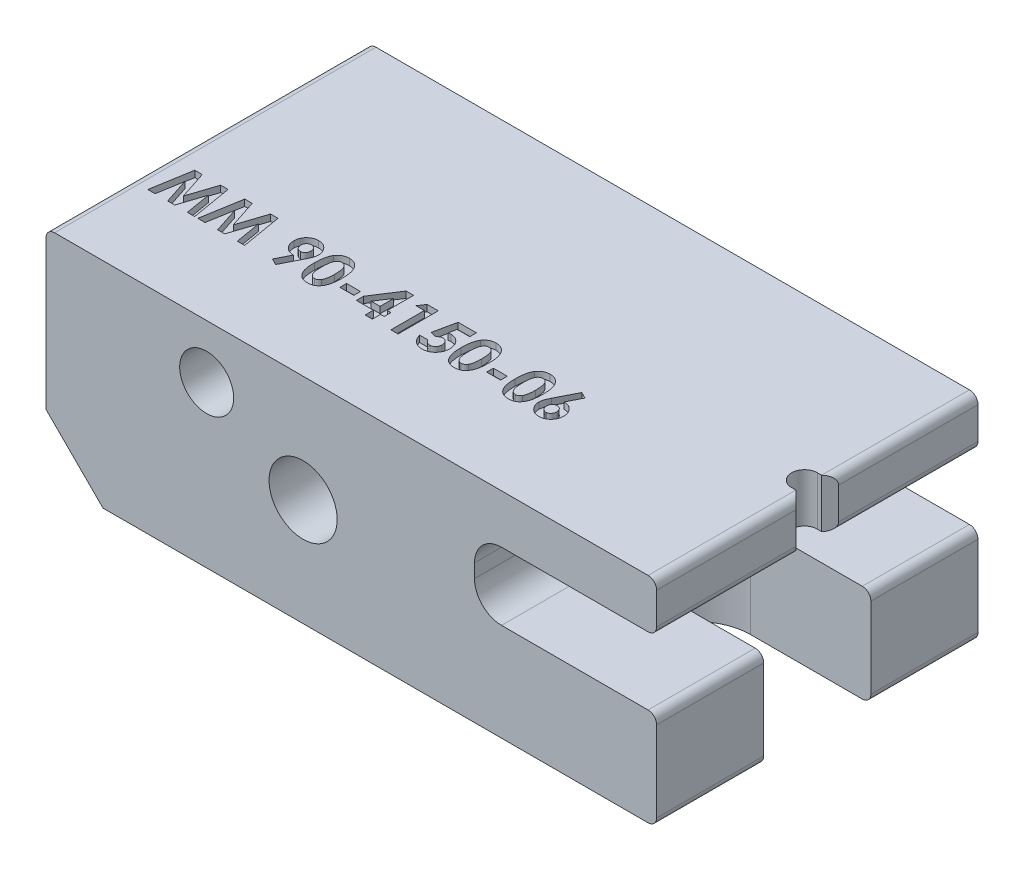
from build123d import *

# Parameters (mm, degrees)
CROQUIS1_W                          = 36.195
CROQUIS1_H                          = 19.05
SALIENTE_EXTRUIR1_DEPTH             = 12.7
TALADRO_ROSCADO_10_321_D            = 4.0386
TALADROS_DE_ESPIGA_DE_1_8_0_126_1_D = 3.2004
CORTAR_EXTRUIR1_DEPTH               = 43.828384571
CORTAR_EXTRUIR2_DEPTH               = 43.828384571
REDONDEO1_R                         = 0.508
CORTAR_EXTRUIR3_DEPTH               = 43.828384571
CORTAR_EXTRUIR4_REACH               = 44.828
CORTAR_EXTRUIR5_DEPTH               = 43.828384646
CROQUIS12_W                         = 0.824278847
CROQUIS12_H                         = 0.396875
CROQUIS12_W_2                       = 0.824278846
CORTAR_EXTRUIR6_DEPTH               = 0.381


with BuildPart() as part:
    # Croquis1 → Saliente-Extruir1 (new body)
    with BuildSketch(Plane(origin=(0, 0, 0), x_dir=(1, 0, 0), z_dir=(0, 1, 0))):
        with Locations((18.0975, -9.525)):
            Rectangle(CROQUIS1_W, CROQUIS1_H)
    extrude(amount=SALIENTE_EXTRUIR1_DEPTH)

    # Taladro roscado #10-321 (through all)
    with Locations(Plane.XY.offset(19.05)):
        with Locations((15.24, 6.35)):
            Hole(TALADRO_ROSCADO_10_321_D / 2)

    # Taladros de espiga de 1/8 (0.126)1 (through all)
    with Locations(Plane.XY.offset(19.05)):
        with Locations((9.525, 9.525)):
            Hole(TALADROS_DE_ESPIGA_DE_1_8_0_126_1_D / 2)

    # Croquis6 → Cortar-Extruir1 (cut, through all)
    with BuildSketch(Plane.XY.offset(19.05)):
        with BuildLine():
            Line((36.195, 5.7912), (27.0002, 5.7912))
            ThreePointArc((27.0002, 5.7912), (25.868687729, 6.259887729), (25.4, 7.3914))
            Line((25.4, 7.3914), (25.4, 8.2042))
            ThreePointArc((25.4, 8.2042), (25.868687729, 9.335712271), (27.0002, 9.8044))
            Line((27.0002, 9.8044), (36.195, 9.8044))
            ThreePointArc((36.195, 9.8044), (38.2016, 7.7978), (36.195, 5.7912))
        make_face()
    extrude(amount=-CORTAR_EXTRUIR1_DEPTH, mode=Mode.SUBTRACT)

    # Croquis7 → Cortar-Extruir2 (cut, through all)
    with BuildSketch(Plane.XY.offset(19.05)):
        Polygon((0, 3.3782), (3.3782, 0), (0, 0), align=None)
    extrude(amount=-CORTAR_EXTRUIR2_DEPTH, mode=Mode.SUBTRACT)

    # Redondeo1
    redondeo1_edges = [part.edges().sort_by_distance(p)[0] for p in [
        (36.195, 12.7, 9.525),
        (36.195, 9.8044, 9.525),
        (36.195, 5.7912, 9.525),
        (0, 12.7, 9.525),
        (36.195, 0, 9.525),
    ]]
    fillet(redondeo1_edges, radius=REDONDEO1_R)

    # Croquis8 → Cortar-Extruir3 (cut, through all)
    with BuildSketch(Plane(origin=(0, 12.7, 0), x_dir=(1, 0, 0), z_dir=(0, 1, 0))):
        with BuildLine():
            Line((36.195, -10.287), (35.433, -10.287))
            ThreePointArc((35.433, -10.287), (34.671, -9.525), (35.433, -8.763))
            Line((35.433, -8.763), (36.195, -8.763))
            ThreePointArc((36.195, -8.763), (36.957, -9.525), (36.195, -10.287))
        make_face()
    extrude(amount=-CORTAR_EXTRUIR3_DEPTH, mode=Mode.SUBTRACT)

    # Croquis9 → Cortar-Extruir4 (cut, up to next)
    with BuildSketch(Plane(origin=(0, 0, 0), x_dir=(1, 0, 0), z_dir=(0, 1, 0)), mode=Mode.PRIVATE) as cortar_extruir4_sk1:
        with BuildLine():
            Line((36.195, -12.7), (29.0576, -12.7))
            ThreePointArc((29.0576, -12.7), (25.8826, -9.525), (29.0576, -6.35))
            Line((29.0576, -6.35), (36.195, -6.35))
            ThreePointArc((36.195, -6.35), (39.37, -9.525), (36.195, -12.7))
        make_face()
    cortar_extruir4_tool1 = extrude(cortar_extruir4_sk1.sketch, amount=CORTAR_EXTRUIR4_REACH, mode=Mode.PRIVATE) & part.part
    add(cortar_extruir4_tool1.solids().sort_by_distance((32.6263, 0, 9.525))[0], mode=Mode.SUBTRACT)

    # Croquis11 → Cortar-Extruir5 (cut, through all)
    with BuildSketch(Plane(origin=(0, 12.7, 0), x_dir=(1, 0, 0), z_dir=(0, 1, 0))):
        Polygon((35.687, -8.763), (36.195, -8.255), (36.195, -8.763), align=None)
        Polygon((35.687, -10.287), (36.195, -10.795), (36.195, -10.287), align=None)
    extrude(amount=-CORTAR_EXTRUIR5_DEPTH, mode=Mode.SUBTRACT)

    # Croquis12 → Cortar-Extruir6 (cut)
    # profile 1 of 12: a face of its own
    with BuildSketch(Plane(origin=(0, 12.7, 0), x_dir=(1, 0, 0), z_dir=(0, 1, 0))):
        Polygon((1.45230255, -11.68486249), (1.895924846, -11.68486249), (2.439242904, -13.345822526), (2.986377069, -11.68486249), (3.425706246, -11.68486249), (3.828305404, -14.06611249), (3.395654413, -14.06611249), (3.141406366, -12.562089804), (2.646266642, -14.06611249), (2.229357087, -14.06611249), (1.737079443, -12.562089804), (1.483308409, -14.06611249), (1.050180404, -14.06611249), align=None)
    # profile 2 of 12: a face of its own
    with BuildSketch(Plane(origin=(0, 12.7, 0), x_dir=(1, 0, 0), z_dir=(0, 1, 0))):
        Polygon((4.413600627, -11.68486249), (4.857222922, -11.68486249), (5.400540981, -13.345822526), (5.947675146, -11.68486249), (6.387004323, -11.68486249), (6.789603481, -14.06611249), (6.35695249, -14.06611249), (6.102704443, -12.562089804), (5.607564719, -14.06611249), (5.190655164, -14.06611249), (4.69837752, -12.562089804), (4.444606486, -14.06611249), (4.011478481, -14.06611249), align=None)
    # profile 3 of 12: a face of its own
    with BuildSketch(Plane(origin=(0, 12.7, 0), x_dir=(1, 0, 0), z_dir=(0, 1, 0))):
        with BuildLine():
            Line((8.691932207, -14.127170182), (8.31318371, -13.936364894))
            Line((8.31318371, -13.936364894), (8.728185212, -13.119718259))
            add(Edge.make_bspline(
                [(8.728185212, -13.119718259), (8.703665971, -13.119093296), (8.655528767, -13.117866343), (8.584650491, -13.107670372), (8.516871302, -13.090265199), (8.451392306, -13.067094529), (8.389119058, -13.036031844), (8.329296445, -12.99896016), (8.272752613, -12.954419065), (8.219222453, -12.904353033), (8.170347706, -12.849013861), (8.12792546, -12.789497518), (8.090949592, -12.727313759), (8.06219513, -12.661058742), (8.039099399, -12.591967294), (8.022224493, -12.519681792), (8.012754743, -12.443885092), (8.01143114, -12.392298687), (8.010757327, -12.36603737)],
                knots=[0, 0, 0, 0, 1.014336294, 1.991387562, 2.955278539, 3.906441712, 4.859855302, 5.829322156, 6.813833455, 7.833278715, 8.858926674, 9.863225732, 10.85404919, 11.846815163, 12.845559416, 13.865450493, 14.913355531, 16, 16, 16, 16], degree=3))
            add(Edge.make_bspline(
                [(8.010757327, -12.36603737), (8.011382325, -12.340564151), (8.01261387, -12.2903697), (8.022841971, -12.216700581), (8.039674778, -12.145967464), (8.062768787, -12.078182366), (8.093512789, -12.013802372), (8.12949786, -11.951819443), (8.173487978, -11.893515937), (8.223181845, -11.838639459), (8.277569146, -11.788437171), (8.335269506, -11.744297092), (8.396020571, -11.707400227), (8.45904163, -11.676413667), (8.525471834, -11.653262437), (8.594351191, -11.635795006), (8.666192809, -11.625713801), (8.7149574, -11.624446224), (8.739633529, -11.623804798)],
                knots=[0, 0, 0, 0, 1.055538678, 2.079917126, 3.075849687, 4.065898488, 5.041806164, 6.028602842, 7.031727914, 8.062953097, 9.093756959, 10.095582084, 11.068815425, 12.035667573, 13.000833448, 13.979119574, 14.977382875, 16, 16, 16, 16], degree=3))
            add(Edge.make_bspline(
                [(8.739633529, -11.623804798), (8.765435407, -11.624335901), (8.81617131, -11.625380245), (8.890441857, -11.636904166), (8.96150091, -11.654583968), (9.029637195, -11.678596746), (9.094004826, -11.711187057), (9.1551424, -11.750246771), (9.212846553, -11.79664011), (9.266497586, -11.849029875), (9.315292601, -11.906013546), (9.35854331, -11.965661703), (9.394875742, -12.027857717), (9.424634227, -12.092046509), (9.447815936, -12.158328639), (9.463750407, -12.226798126), (9.474329128, -12.297337883), (9.475532776, -12.345169052), (9.476141943, -12.369376462)],
                knots=[0, 0, 0, 0, 1.062826075, 2.08990367, 3.089830715, 4.078784409, 5.060762809, 6.057138927, 7.064407536, 8.107320944, 9.143871033, 10.153461498, 11.140480137, 12.108246174, 13.065926856, 14.029354859, 15.002654194, 16, 16, 16, 16], degree=3))
            add(Edge.make_bspline(
                [(9.476141943, -12.369376462), (9.475809515, -12.387838879), (9.475139929, -12.425026338), (9.468556058, -12.480792964), (9.458566999, -12.536714152), (9.446972581, -12.583730002), (9.434817447, -12.623361508), (9.422989117, -12.65698149), (9.407813022, -12.694305984), (9.390867394, -12.735585165), (9.371242364, -12.78063802), (9.34853104, -12.829249179), (9.324106035, -12.882139594), (9.306102395, -12.918305339), (9.296784972, -12.937022196)],
                knots=[0, 0, 0, 0, 1.105131805, 2.225983929, 3.357782449, 4.505488967, 5.122909461, 5.839607681, 6.638776516, 7.535249922, 8.51168636, 9.581005249, 10.748097757, 12, 12, 12, 12], degree=3))
            Line((9.296784972, -12.937022196), (8.691932207, -14.127170182))
        make_face()
        with BuildLine():
            add(Edge.make_bspline(
                [(8.749173794, -12.722843259), (8.769653205, -12.721637577), (8.809665339, -12.719281947), (8.867140107, -12.701067712), (8.918577103, -12.669898209), (8.96416758, -12.62848911), (9.001842154, -12.577968114), (9.029234035, -12.520454452), (9.046106591, -12.457139167), (9.047844079, -12.413050637), (9.048738097, -12.390365044)],
                knots=[0, 0, 0, 0, 0.984774978, 1.924027336, 2.867853169, 3.859505234, 4.871392407, 5.881338128, 6.909850265, 8, 8, 8, 8], degree=3))
            add(Edge.make_bspline(
                [(9.048738097, -12.390365044), (9.047661349, -12.367207539), (9.045566819, -12.322160662), (9.028532631, -12.257325568), (8.99942463, -12.198718488), (8.959824861, -12.147772796), (8.913592646, -12.10513776), (8.86189336, -12.073994014), (8.80598237, -12.05473572), (8.767290008, -12.052392454), (8.747742754, -12.051208644)],
                knots=[0, 0, 0, 0, 1.104110315, 2.147758178, 3.172670271, 4.206310416, 5.210906102, 6.157051016, 7.068948237, 8, 8, 8, 8], degree=3))
            add(Edge.make_bspline(
                [(8.747742754, -12.051208644), (8.727082404, -12.052362706), (8.686515976, -12.054628698), (8.628327346, -12.073840745), (8.574686565, -12.104386427), (8.527843289, -12.147166121), (8.48730223, -12.197440875), (8.459031843, -12.25624578), (8.441147015, -12.32062843), (8.43917435, -12.36575609), (8.438161174, -12.388934004)],
                knots=[0, 0, 0, 0, 0.970967322, 1.90648639, 2.855811969, 3.858352357, 4.877096915, 5.878517833, 6.91039038, 8, 8, 8, 8], degree=3))
            add(Edge.make_bspline(
                [(8.438161174, -12.388934004), (8.439219499, -12.411781535), (8.441277831, -12.456217596), (8.458528748, -12.519891967), (8.486628764, -12.577709996), (8.52504349, -12.628629421), (8.572360973, -12.670242548), (8.626086331, -12.701080032), (8.686015726, -12.719331335), (8.727742132, -12.721651545), (8.749173794, -12.722843259)],
                knots=[0, 0, 0, 0, 1.075706617, 2.092137047, 3.084482865, 4.090466434, 5.0784141, 6.035155512, 6.990809768, 8, 8, 8, 8], degree=3))
        make_face(mode=Mode.SUBTRACT)
    # profile 4 of 12: a face of its own
    with BuildSketch(Plane(origin=(0, 12.7, 0), x_dir=(1, 0, 0), z_dir=(0, 1, 0))):
        with BuildLine():
            add(Edge.make_bspline(
                [(10.552760783, -11.623804798), (10.573448903, -11.624111919), (10.614127275, -11.624715801), (10.674038859, -11.631256333), (10.731750279, -11.641137254), (10.787487309, -11.654917693), (10.840848749, -11.673155614), (10.892222973, -11.694986092), (10.940998481, -11.721554181), (10.987797315, -11.751564202), (11.032601449, -11.785539801), (11.074334046, -11.824273737), (11.113757233, -11.866874742), (11.150017642, -11.913986866), (11.183918272, -11.965181575), (11.21534773, -12.020466987), (11.244065417, -12.080113686), (11.27039319, -12.144229309), (11.293935567, -12.213774923), (11.313765282, -12.289548245), (11.33077258, -12.371566581), (11.34512794, -12.460034085), (11.355978273, -12.555068352), (11.363291615, -12.656606246), (11.368310376, -12.764452018), (11.368719973, -12.838433331), (11.368930404, -12.876441516)],
                knots=[0, 0, 0, 0, 0.879237366, 1.728815576, 2.559023295, 3.367336655, 4.166867292, 4.954216142, 5.737608147, 6.525189134, 7.316157332, 8.124696809, 8.942788509, 9.781158001, 10.649253743, 11.551476218, 12.482711956, 13.461909668, 14.496590415, 15.601789533, 16.789733467, 18.056700938, 19.410929216, 20.8549011, 22.384193279, 24, 24, 24, 24], degree=3))
            add(Edge.make_bspline(
                [(11.368930404, -12.876441516), (11.368702985, -12.914925227), (11.368261112, -12.989698387), (11.363500246, -13.098530571), (11.35530181, -13.200805691), (11.344735074, -13.296513167), (11.330261537, -13.385602458), (11.313311012, -13.468304244), (11.293168291, -13.544588547), (11.268850435, -13.614283485), (11.242682026, -13.678511709), (11.213885784, -13.738042111), (11.182963623, -13.793035932), (11.150624806, -13.844322828), (11.115096398, -13.890390887), (11.078107669, -13.932806665), (11.038048062, -13.96995449), (10.996604241, -14.003748794), (10.952257953, -14.032953855), (10.905466528, -14.058496119), (10.855395757, -14.079213929), (10.802958344, -14.097233174), (10.747260485, -14.110169048), (10.689187208, -14.120433238), (10.628082881, -14.126105859), (10.586480593, -14.126809585), (10.565163127, -14.127170182)],
                knots=[0, 0, 0, 0, 1.643780988, 3.193836972, 4.651895693, 6.025988579, 7.305620092, 8.505800249, 9.631074763, 10.672816429, 11.65661981, 12.592235626, 13.49536222, 14.350718032, 15.179365177, 15.97804903, 16.751647189, 17.51006938, 18.259804725, 19.016521909, 19.783502495, 20.571750527, 21.382245291, 22.22305063, 23.089471752, 24, 24, 24, 24], degree=3))
            add(Edge.make_bspline(
                [(10.565163127, -14.127170182), (10.543846236, -14.12680263), (10.50208676, -14.1260826), (10.4408172, -14.120475417), (10.382436165, -14.110127467), (10.326297646, -14.097133862), (10.272792357, -14.079253799), (10.221663744, -14.057916127), (10.17330494, -14.032533233), (10.127582048, -14.003260127), (10.084651178, -13.969691933), (10.043845186, -13.932187698), (10.005254336, -13.890842488), (9.969465691, -13.845193202), (9.935893137, -13.795849161), (9.904886782, -13.742246882), (9.87646526, -13.684464408), (9.84973954, -13.622421196), (9.826518273, -13.554781527), (9.805852424, -13.480941387), (9.788923504, -13.400285258), (9.775308133, -13.312839052), (9.764437629, -13.218788027), (9.756351224, -13.118086787), (9.751563913, -13.010688428), (9.751126675, -12.936868186), (9.750901558, -12.898861138)],
                knots=[0, 0, 0, 0, 0.917216111, 1.796812873, 2.643793957, 3.46689424, 4.273913431, 5.068098542, 5.848489301, 6.620921603, 7.401012384, 8.190319798, 9.003608147, 9.831726257, 10.68377682, 11.569763213, 12.493818149, 13.453288342, 14.474581811, 15.568529029, 16.750744269, 18.018426408, 19.375425659, 20.823733699, 22.36466933, 24, 24, 24, 24], degree=3))
            add(Edge.make_bspline(
                [(9.750901558, -12.898861138), (9.751309336, -12.846053337), (9.752096147, -12.744160004), (9.762067203, -12.596953765), (9.776702185, -12.460887096), (9.798197505, -12.336187604), (9.824776172, -12.222393438), (9.858811539, -12.120254216), (9.897558328, -12.028356611), (9.93057557, -11.973915916), (9.946476979, -11.947696775)],
                knots=[0, 0, 0, 0, 1.288568992, 2.486310467, 3.599230591, 4.627010532, 5.572937695, 6.447898582, 7.252493626, 8, 8, 8, 8], degree=3))
            add(Edge.make_bspline(
                [(9.946476979, -11.947696775), (9.96496638, -11.921939099), (10.001116801, -11.871577767), (10.064326824, -11.805462751), (10.132237763, -11.748917952), (10.206244471, -11.70322303), (10.285176502, -11.66718801), (10.369711525, -11.641736881), (10.459537369, -11.626907868), (10.521222274, -11.624854601), (10.552760783, -11.623804798)],
                knots=[0, 0, 0, 0, 1.058512271, 2.069600068, 3.047294572, 4.004278952, 4.967380941, 5.939006123, 6.946246673, 8, 8, 8, 8], degree=3))
        make_face()
        with BuildLine():
            add(Edge.make_bspline(
                [(10.563255074, -12.051208644), (10.544552842, -12.052095092), (10.507886539, -12.053833002), (10.454681987, -12.068585405), (10.404513416, -12.091371286), (10.366351524, -12.118790532), (10.337787728, -12.145075167), (10.317829998, -12.168861907), (10.298583914, -12.195406194), (10.281584803, -12.225905837), (10.265533204, -12.259264945), (10.249845955, -12.295634951), (10.236986529, -12.33590918), (10.224352484, -12.379401756), (10.213283882, -12.427315134), (10.20401082, -12.480040952), (10.195726155, -12.537922093), (10.189947502, -12.600996467), (10.184560063, -12.669198084), (10.180698091, -12.74267887), (10.179083498, -12.821419002), (10.178570268, -12.875646162), (10.178305404, -12.90363127)],
                knots=[0, 0, 0, 0, 1.076674018, 2.110852608, 3.161083442, 4.239746716, 4.804137807, 5.395870207, 6.026861976, 6.692161227, 7.405688833, 8.16177676, 8.973626916, 9.841385931, 10.773283133, 11.807421078, 12.927755683, 14.143907515, 15.458935494, 16.872852025, 18.386167141, 20, 20, 20, 20], degree=3))
            add(Edge.make_bspline(
                [(10.178305404, -12.90363127), (10.178741338, -12.93988733), (10.179577272, -13.009411013), (10.183955506, -13.10938849), (10.192731312, -13.200376045), (10.203646643, -13.282990334), (10.218977671, -13.35669558), (10.236617011, -13.422189105), (10.258400027, -13.478636024), (10.2835745, -13.526852687), (10.311456363, -13.567870502), (10.341723352, -13.60273583), (10.373344984, -13.632927559), (10.407308274, -13.657451928), (10.443532194, -13.676246274), (10.481714343, -13.689764815), (10.521878983, -13.698040077), (10.549383315, -13.69918759), (10.563255074, -13.699766336)],
                knots=[0, 0, 0, 0, 1.771748488, 3.397459088, 4.888034009, 6.237357457, 7.467047327, 8.564189669, 9.548206622, 10.417051504, 11.216568818, 11.965764335, 12.669334354, 13.348544111, 14.005342236, 14.656555988, 15.322436492, 16, 16, 16, 16], degree=3))
            add(Edge.make_bspline(
                [(10.563255074, -13.699766336), (10.576650798, -13.699370315), (10.60287796, -13.698594955), (10.641123037, -13.690635991), (10.677290298, -13.677696443), (10.711270545, -13.659392544), (10.74318532, -13.636116336), (10.772878643, -13.607765533), (10.800126572, -13.574057545), (10.81600134, -13.549041232), (10.824181306, -13.536150801)],
                knots=[0, 0, 0, 0, 0.992283464, 1.942767638, 2.88273346, 3.832339453, 4.79467288, 5.803907806, 6.868395428, 8, 8, 8, 8], degree=3))
            add(Edge.make_bspline(
                [(10.824181306, -13.536150801), (10.833811838, -13.51853644), (10.854006283, -13.481600552), (10.87737533, -13.41927262), (10.897046092, -13.348977013), (10.913976428, -13.270494965), (10.925555746, -13.183516934), (10.93552784, -13.088594455), (10.940337628, -12.985249536), (10.941119967, -12.913651804), (10.941526558, -12.876441516)],
                knots=[0, 0, 0, 0, 0.710965849, 1.490837728, 2.352621235, 3.297892224, 4.334225155, 5.461620853, 6.680770821, 8, 8, 8, 8], degree=3))
            add(Edge.make_bspline(
                [(10.941526558, -12.876441516), (10.941369501, -12.838908226), (10.941067192, -12.766663048), (10.935520698, -12.662946597), (10.927796781, -12.568218833), (10.916498921, -12.482691243), (10.901962171, -12.406156204), (10.884045571, -12.33861872), (10.862923233, -12.279945687), (10.837874656, -12.230195611), (10.810131802, -12.18791487), (10.780681915, -12.151641274), (10.74940047, -12.120671793), (10.716339779, -12.094889884), (10.68073464, -12.075190571), (10.64326516, -12.061281227), (10.603854521, -12.05286654), (10.576970886, -12.051768735), (10.563255074, -12.051208644)],
                knots=[0, 0, 0, 0, 1.793836731, 3.452829483, 4.963243077, 6.335886805, 7.574563692, 8.684454726, 9.672768357, 10.54971625, 11.340229787, 12.085688095, 12.778991901, 13.440269426, 14.083255152, 14.715733572, 15.344777694, 16, 16, 16, 16], degree=3))
        make_face(mode=Mode.SUBTRACT)
    # profile 5 of 12: a face of its own
    with BuildSketch(Plane(origin=(0, 12.7, 0), x_dir=(1, 0, 0), z_dir=(0, 1, 0))):
        with Locations((12.177944827, -13.196040375)):
            Rectangle(CROQUIS12_W, CROQUIS12_H)
    # profile 6 of 12: a face of its own
    with BuildSketch(Plane(origin=(0, 12.7, 0), x_dir=(1, 0, 0), z_dir=(0, 1, 0))):
        Polygon((13.915226979, -11.623804798), (14.360757327, -11.623804798), (14.360757327, -13.180775952), (14.574459251, -13.180775952), (14.574459251, -13.577650952), (14.360757327, -13.577650952), (14.360757327, -14.06611249), (13.933353481, -14.06611249), (13.933353481, -13.577650952), (12.925901558, -13.577650952), (12.925901558, -13.14499996), align=None)
        Polygon((13.933353481, -13.180775952), (13.933353481, -12.370330489), (13.406253872, -13.180775952), align=None, mode=Mode.SUBTRACT)
    # profile 7 of 12: a face of its own
    with BuildSketch(Plane(origin=(0, 12.7, 0), x_dir=(1, 0, 0), z_dir=(0, 1, 0))):
        Polygon((15.226536324, -11.68486249), (15.887199635, -11.68486249), (15.887199635, -14.06611249), (15.459795789, -14.06611249), (15.459795789, -12.08173749), (14.971334251, -12.08173749), align=None)
    # profile 8 of 12: a face of its own
    with BuildSketch(Plane(origin=(0, 12.7, 0), x_dir=(1, 0, 0), z_dir=(0, 1, 0))):
        with BuildLine():
            Line((17.062083199, -11.68486249), (18.146334251, -11.68486249))
            Line((18.146334251, -11.68486249), (18.146334251, -12.08173749))
            Line((18.146334251, -12.08173749), (17.400762586, -12.08173749))
            Line((17.400762586, -12.08173749), (17.307745008, -12.532037971))
            add(Edge.make_bspline(
                [(17.307745008, -12.532037971), (17.320419984, -12.52850783), (17.345417642, -12.521545666), (17.383076645, -12.514563498), (17.419573467, -12.510037878), (17.443522458, -12.50943422), (17.455142093, -12.509141336)],
                knots=[0, 0, 0, 0, 1.05461699, 2.079921384, 3.068411212, 4, 4, 4, 4], degree=3))
            add(Edge.make_bspline(
                [(17.455142093, -12.509141336), (17.480462494, -12.509721538), (17.530374583, -12.510865245), (17.603389635, -12.521722751), (17.673305861, -12.538822994), (17.739909309, -12.563211469), (17.803134917, -12.594953699), (17.863059326, -12.633352899), (17.919756084, -12.678476512), (17.972218017, -12.730352789), (18.020422233, -12.787314117), (18.062333049, -12.848923819), (18.098127502, -12.914303403), (18.126597172, -12.983859265), (18.149067862, -13.057154549), (18.165305685, -13.134236224), (18.174907921, -13.215195644), (18.176202724, -13.270428468), (18.176863097, -13.298598217)],
                knots=[0, 0, 0, 0, 1.01440847, 1.999622559, 2.951875003, 3.895578053, 4.836219714, 5.782137149, 6.743708247, 7.735272588, 8.734977101, 9.730283169, 10.717124674, 11.717316708, 12.737475749, 13.78628267, 14.87096371, 16, 16, 16, 16], degree=3))
            add(Edge.make_bspline(
                [(18.176863097, -13.298598217), (18.17605611, -13.327087758), (18.17446369, -13.383305951), (18.164074608, -13.46596658), (18.145737692, -13.545136802), (18.120550102, -13.621028554), (18.087367066, -13.693084048), (18.047459923, -13.762049727), (18.000153951, -13.82741368), (17.945913384, -13.888505848), (17.886946774, -13.944345262), (17.824161252, -13.993467301), (17.757997908, -14.034803099), (17.688455145, -14.068209413), (17.615931951, -14.094639893), (17.540406315, -14.113880021), (17.461511192, -14.124913166), (17.407951654, -14.126409576), (17.380728031, -14.127170182)],
                knots=[0, 0, 0, 0, 1.06808661, 2.107647099, 3.116961351, 4.110378221, 5.100014249, 6.085620622, 7.093190682, 8.119403071, 9.144090782, 10.133780668, 11.103064255, 12.062861538, 13.020824475, 13.992378307, 14.979551724, 16, 16, 16, 16], degree=3))
            add(Edge.make_bspline(
                [(17.380728031, -14.127170182), (17.356382754, -14.126547959), (17.308368774, -14.125320805), (17.237646289, -14.117778068), (17.169461961, -14.104442438), (17.104177772, -14.085142329), (17.041106825, -14.061388301), (16.980978237, -14.0316794), (16.923461592, -13.996581323), (16.868720215, -13.956734612), (16.817643576, -13.911848836), (16.771026231, -13.862713622), (16.728585955, -13.809948293), (16.691230902, -13.752901887), (16.659078169, -13.691658685), (16.630564469, -13.626940455), (16.60722572, -13.558071329), (16.595381978, -13.510327425), (16.589363097, -13.486064413)],
                knots=[0, 0, 0, 0, 1.054957082, 2.080596141, 3.077793124, 4.061112343, 5.027190972, 5.994718051, 6.962465889, 7.943658696, 8.924948258, 9.904494768, 10.875059, 11.855380583, 12.854004648, 13.869083016, 14.917087635, 16, 16, 16, 16], degree=3))
            Line((16.589363097, -13.486064413), (17.077824635, -13.486064413))
            add(Edge.make_bspline(
                [(17.077824635, -13.486064413), (17.086753724, -13.502877692), (17.104106389, -13.535552382), (17.137114994, -13.578932941), (17.174066031, -13.615926019), (17.214626183, -13.646893045), (17.259058254, -13.670093014), (17.305551721, -13.687686797), (17.354690661, -13.697853593), (17.388156449, -13.699124543), (17.405055705, -13.699766336)],
                knots=[0, 0, 0, 0, 1.104910296, 2.147267069, 3.153527244, 4.136738762, 5.099945312, 6.05603338, 7.018353, 8, 8, 8, 8], degree=3))
            add(Edge.make_bspline(
                [(17.405055705, -13.699766336), (17.41683426, -13.699323172), (17.440008765, -13.69845124), (17.474152734, -13.6938385), (17.506744653, -13.685102075), (17.538026834, -13.673004156), (17.568083309, -13.657916686), (17.596483209, -13.638869738), (17.623720641, -13.616945994), (17.64938094, -13.591788424), (17.672621775, -13.563743585), (17.693001445, -13.533607494), (17.71122368, -13.502049781), (17.724721168, -13.467820365), (17.73577447, -13.43194135), (17.743914568, -13.39414209), (17.748779195, -13.354378436), (17.749229529, -13.327232905), (17.749459251, -13.313385627)],
                knots=[0, 0, 0, 0, 0.978869489, 1.925942215, 2.855067702, 3.774946051, 4.70828698, 5.642468714, 6.60995405, 7.609372294, 8.622401667, 9.629904756, 10.629323, 11.642352373, 12.678539694, 13.745912462, 14.850161547, 16, 16, 16, 16], degree=3))
            add(Edge.make_bspline(
                [(17.749459251, -13.313385627), (17.749192633, -13.299859776), (17.748673654, -13.273531379), (17.74438056, -13.234871861), (17.736700299, -13.198190975), (17.726235876, -13.163207773), (17.712840166, -13.13013469), (17.696469713, -13.098774858), (17.677054581, -13.06928679), (17.654490533, -13.042270834), (17.630428465, -13.017491031), (17.604578072, -12.995818813), (17.577172252, -12.977832377), (17.549062608, -12.962129695), (17.519127104, -12.950701625), (17.488038869, -12.942831535), (17.455830596, -12.937056779), (17.433862032, -12.936717491), (17.422705194, -12.936545182)],
                knots=[0, 0, 0, 0, 1.166249705, 2.270133367, 3.348514167, 4.393962215, 5.415026464, 6.420877785, 7.440098956, 8.453121383, 9.451844239, 10.415694839, 11.355045125, 12.27538808, 13.187007209, 14.108269027, 15.039275622, 16, 16, 16, 16], degree=3))
            add(Edge.make_bspline(
                [(17.422705194, -12.936545182), (17.410586276, -12.937005028), (17.386297363, -12.937926657), (17.350210118, -12.945425709), (17.314557985, -12.957561987), (17.279142701, -12.974305906), (17.244315824, -12.996218413), (17.209158257, -13.021919272), (17.174846798, -13.053275893), (17.153030617, -13.076630376), (17.141744407, -13.0887124)],
                knots=[0, 0, 0, 0, 0.88288272, 1.769486374, 2.674910571, 3.623812639, 4.617874466, 5.670434592, 6.794841017, 8, 8, 8, 8], degree=3))
            Line((17.141744407, -13.0887124), (16.782076438, -13.006189113))
            Line((16.782076438, -13.006189113), (17.062083199, -11.68486249))
        make_face()
    # profile 9 of 12: a face of its own
    with BuildSketch(Plane(origin=(0, 12.7, 0), x_dir=(1, 0, 0), z_dir=(0, 1, 0))):
        with BuildLine():
            add(Edge.make_bspline(
                [(19.253481937, -11.623804798), (19.274170057, -11.624111919), (19.314848429, -11.624715801), (19.374760013, -11.631256333), (19.432471433, -11.641137254), (19.488208463, -11.654917693), (19.541569903, -11.673155614), (19.592944127, -11.694986092), (19.641719635, -11.721554181), (19.688518469, -11.751564202), (19.733322602, -11.785539801), (19.7750552, -11.824273737), (19.814478386, -11.866874742), (19.850738796, -11.913986866), (19.884639426, -11.965181575), (19.916068884, -12.020466987), (19.944786571, -12.080113686), (19.971114343, -12.144229309), (19.99465672, -12.213774923), (20.014486435, -12.289548245), (20.031493734, -12.371566581), (20.045849094, -12.460034085), (20.056699426, -12.555068352), (20.064012769, -12.656606246), (20.06903153, -12.764452018), (20.069441127, -12.838433331), (20.069651558, -12.876441516)],
                knots=[0, 0, 0, 0, 0.879237366, 1.728815576, 2.559023295, 3.367336655, 4.166867292, 4.954216142, 5.737608147, 6.525189134, 7.316157332, 8.124696809, 8.942788509, 9.781158001, 10.649253743, 11.551476218, 12.482711956, 13.461909668, 14.496590415, 15.601789533, 16.789733467, 18.056700938, 19.410929216, 20.8549011, 22.384193279, 24, 24, 24, 24], degree=3))
            add(Edge.make_bspline(
                [(20.069651558, -12.876441516), (20.069424138, -12.914925227), (20.068982266, -12.989698387), (20.0642214, -13.098530571), (20.056022964, -13.200805691), (20.045456228, -13.296513167), (20.03098269, -13.385602458), (20.014032166, -13.468304244), (19.993889445, -13.544588547), (19.969571589, -13.614283485), (19.94340318, -13.678511709), (19.914606938, -13.738042111), (19.883684777, -13.793035932), (19.85134596, -13.844322828), (19.815817552, -13.890390887), (19.778828823, -13.932806665), (19.738769215, -13.96995449), (19.697325395, -14.003748794), (19.652979107, -14.032953855), (19.606187682, -14.058496119), (19.556116911, -14.079213929), (19.503679498, -14.097233174), (19.447981638, -14.110169048), (19.389908362, -14.120433238), (19.328804034, -14.126105859), (19.287201747, -14.126809585), (19.265884281, -14.127170182)],
                knots=[0, 0, 0, 0, 1.643780988, 3.193836972, 4.651895693, 6.025988579, 7.305620092, 8.505800249, 9.631074763, 10.672816429, 11.65661981, 12.592235626, 13.49536222, 14.350718032, 15.179365177, 15.97804903, 16.751647189, 17.51006938, 18.259804725, 19.016521909, 19.783502495, 20.571750527, 21.382245291, 22.22305063, 23.089471752, 24, 24, 24, 24], degree=3))
            add(Edge.make_bspline(
                [(19.265884281, -14.127170182), (19.24456739, -14.12680263), (19.202807914, -14.1260826), (19.141538354, -14.120475417), (19.083157319, -14.110127467), (19.027018799, -14.097133862), (18.973513511, -14.079253799), (18.922384897, -14.057916127), (18.874026094, -14.032533233), (18.828303201, -14.003260127), (18.785372332, -13.969691933), (18.74456634, -13.932187698), (18.70597549, -13.890842488), (18.670186845, -13.845193202), (18.636614291, -13.795849161), (18.605607935, -13.742246882), (18.577186414, -13.684464408), (18.550460694, -13.622421196), (18.527239427, -13.554781527), (18.506573578, -13.480941387), (18.489644657, -13.400285258), (18.476029287, -13.312839052), (18.465158783, -13.218788027), (18.457072377, -13.118086787), (18.452285067, -13.010688428), (18.451847829, -12.936868186), (18.451622712, -12.898861138)],
                knots=[0, 0, 0, 0, 0.917216111, 1.796812873, 2.643793957, 3.46689424, 4.273913431, 5.068098542, 5.848489301, 6.620921603, 7.401012384, 8.190319798, 9.003608147, 9.831726257, 10.68377682, 11.569763213, 12.493818149, 13.453288342, 14.474581811, 15.568529029, 16.750744269, 18.018426408, 19.375425659, 20.823733699, 22.36466933, 24, 24, 24, 24], degree=3))
            add(Edge.make_bspline(
                [(18.451622712, -12.898861138), (18.452030489, -12.846053337), (18.452817301, -12.744160004), (18.462788357, -12.596953765), (18.477423338, -12.460887096), (18.498918659, -12.336187604), (18.525497326, -12.222393438), (18.559532693, -12.120254216), (18.598279482, -12.028356611), (18.631296724, -11.973915916), (18.647198133, -11.947696775)],
                knots=[0, 0, 0, 0, 1.288568992, 2.486310467, 3.599230591, 4.627010532, 5.572937695, 6.447898582, 7.252493626, 8, 8, 8, 8], degree=3))
            add(Edge.make_bspline(
                [(18.647198133, -11.947696775), (18.665687533, -11.921939099), (18.701837955, -11.871577767), (18.765047978, -11.805462751), (18.832958917, -11.748917952), (18.906965625, -11.70322303), (18.985897655, -11.66718801), (19.070432679, -11.641736881), (19.160258523, -11.626907868), (19.221943428, -11.624854601), (19.253481937, -11.623804798)],
                knots=[0, 0, 0, 0, 1.058512271, 2.069600068, 3.047294572, 4.004278952, 4.967380941, 5.939006123, 6.946246673, 8, 8, 8, 8], degree=3))
        make_face()
        with BuildLine():
            add(Edge.make_bspline(
                [(19.263976228, -12.051208644), (19.245273996, -12.052095092), (19.208607693, -12.053833002), (19.155403141, -12.068585405), (19.10523457, -12.091371286), (19.067072678, -12.118790532), (19.038508881, -12.145075167), (19.018551152, -12.168861907), (18.999305068, -12.195406194), (18.982305956, -12.225905837), (18.966254358, -12.259264945), (18.950567108, -12.295634951), (18.937707683, -12.33590918), (18.925073638, -12.379401756), (18.914005036, -12.427315134), (18.904731974, -12.480040952), (18.896447309, -12.537922093), (18.890668655, -12.600996467), (18.885281216, -12.669198084), (18.881419245, -12.74267887), (18.879804652, -12.821419002), (18.879291422, -12.875646162), (18.879026558, -12.90363127)],
                knots=[0, 0, 0, 0, 1.076674018, 2.110852608, 3.161083442, 4.239746716, 4.804137807, 5.395870207, 6.026861976, 6.692161227, 7.405688833, 8.16177676, 8.973626916, 9.841385931, 10.773283133, 11.807421078, 12.927755683, 14.143907515, 15.458935494, 16.872852025, 18.386167141, 20, 20, 20, 20], degree=3))
            add(Edge.make_bspline(
                [(18.879026558, -12.90363127), (18.879462492, -12.93988733), (18.880298426, -13.009411013), (18.88467666, -13.10938849), (18.893452466, -13.200376045), (18.904367797, -13.282990334), (18.919698825, -13.35669558), (18.937338165, -13.422189105), (18.959121181, -13.478636024), (18.984295654, -13.526852687), (19.012177517, -13.567870502), (19.042444506, -13.60273583), (19.074066138, -13.632927559), (19.108029428, -13.657451928), (19.144253348, -13.676246274), (19.182435497, -13.689764815), (19.222600137, -13.698040077), (19.250104469, -13.69918759), (19.263976228, -13.699766336)],
                knots=[0, 0, 0, 0, 1.771748488, 3.397459088, 4.888034009, 6.237357457, 7.467047327, 8.564189669, 9.548206622, 10.417051504, 11.216568818, 11.965764335, 12.669334354, 13.348544111, 14.005342236, 14.656555988, 15.322436492, 16, 16, 16, 16], degree=3))
            add(Edge.make_bspline(
                [(19.263976228, -13.699766336), (19.277371952, -13.699370315), (19.303599114, -13.698594955), (19.34184419, -13.690635991), (19.378011452, -13.677696443), (19.411991699, -13.659392544), (19.443906474, -13.636116336), (19.473599797, -13.607765533), (19.500847726, -13.574057545), (19.516722494, -13.549041232), (19.52490246, -13.536150801)],
                knots=[0, 0, 0, 0, 0.992283464, 1.942767638, 2.88273346, 3.832339453, 4.79467288, 5.803907806, 6.868395428, 8, 8, 8, 8], degree=3))
            add(Edge.make_bspline(
                [(19.52490246, -13.536150801), (19.534532992, -13.51853644), (19.554727437, -13.481600552), (19.578096484, -13.41927262), (19.597767245, -13.348977013), (19.614697582, -13.270494965), (19.626276899, -13.183516934), (19.636248993, -13.088594455), (19.641058782, -12.985249536), (19.641841121, -12.913651804), (19.642247712, -12.876441516)],
                knots=[0, 0, 0, 0, 0.710965849, 1.490837728, 2.352621235, 3.297892224, 4.334225155, 5.461620853, 6.680770821, 8, 8, 8, 8], degree=3))
            add(Edge.make_bspline(
                [(19.642247712, -12.876441516), (19.642090655, -12.838908226), (19.641788346, -12.766663048), (19.636241852, -12.662946597), (19.628517935, -12.568218833), (19.617220075, -12.482691243), (19.602683325, -12.406156204), (19.584766725, -12.33861872), (19.563644386, -12.279945687), (19.53859581, -12.230195611), (19.510852956, -12.18791487), (19.481403069, -12.151641274), (19.450121624, -12.120671793), (19.417060932, -12.094889884), (19.381455794, -12.075190571), (19.343986313, -12.061281227), (19.304575675, -12.05286654), (19.27769204, -12.051768735), (19.263976228, -12.051208644)],
                knots=[0, 0, 0, 0, 1.793836731, 3.452829483, 4.963243077, 6.335886805, 7.574563692, 8.684454726, 9.672768357, 10.54971625, 11.340229787, 12.085688095, 12.778991901, 13.440269426, 14.083255152, 14.715733572, 15.344777694, 16, 16, 16, 16], degree=3))
        make_face(mode=Mode.SUBTRACT)
    # profile 10 of 12: a face of its own
    with BuildSketch(Plane(origin=(0, 12.7, 0), x_dir=(1, 0, 0), z_dir=(0, 1, 0))):
        with Locations((20.878665981, -13.196040375)):
            Rectangle(CROQUIS12_W_2, CROQUIS12_H)
    # profile 11 of 12: a face of its own
    with BuildSketch(Plane(origin=(0, 12.7, 0), x_dir=(1, 0, 0), z_dir=(0, 1, 0))):
        with BuildLine():
            add(Edge.make_bspline(
                [(22.459010783, -11.623804798), (22.479698903, -11.624111919), (22.520377275, -11.624715801), (22.580288859, -11.631256333), (22.638000279, -11.641137254), (22.693737309, -11.654917693), (22.747098749, -11.673155614), (22.798472973, -11.694986092), (22.847248481, -11.721554181), (22.894047315, -11.751564202), (22.938851449, -11.785539801), (22.980584046, -11.824273737), (23.020007233, -11.866874742), (23.056267642, -11.913986866), (23.090168272, -11.965181575), (23.12159773, -12.020466987), (23.150315417, -12.080113686), (23.17664319, -12.144229309), (23.200185567, -12.213774923), (23.220015282, -12.289548245), (23.23702258, -12.371566581), (23.25137794, -12.460034085), (23.262228273, -12.555068352), (23.269541615, -12.656606246), (23.274560376, -12.764452018), (23.274969973, -12.838433331), (23.275180404, -12.876441516)],
                knots=[0, 0, 0, 0, 0.879237366, 1.728815576, 2.559023295, 3.367336655, 4.166867292, 4.954216142, 5.737608147, 6.525189134, 7.316157332, 8.124696809, 8.942788509, 9.781158001, 10.649253743, 11.551476218, 12.482711956, 13.461909668, 14.496590415, 15.601789533, 16.789733467, 18.056700938, 19.410929216, 20.8549011, 22.384193279, 24, 24, 24, 24], degree=3))
            add(Edge.make_bspline(
                [(23.275180404, -12.876441516), (23.274952985, -12.914925227), (23.274511112, -12.989698387), (23.269750246, -13.098530571), (23.26155181, -13.200805691), (23.250985074, -13.296513167), (23.236511537, -13.385602458), (23.219561012, -13.468304244), (23.199418291, -13.544588547), (23.175100435, -13.614283485), (23.148932026, -13.678511709), (23.120135784, -13.738042111), (23.089213623, -13.793035932), (23.056874806, -13.844322828), (23.021346398, -13.890390887), (22.984357669, -13.932806665), (22.944298062, -13.96995449), (22.902854241, -14.003748794), (22.858507953, -14.032953855), (22.811716528, -14.058496119), (22.761645757, -14.079213929), (22.709208344, -14.097233174), (22.653510485, -14.110169048), (22.595437208, -14.120433238), (22.534332881, -14.126105859), (22.492730593, -14.126809585), (22.471413127, -14.127170182)],
                knots=[0, 0, 0, 0, 1.643780988, 3.193836972, 4.651895693, 6.025988579, 7.305620092, 8.505800249, 9.631074763, 10.672816429, 11.65661981, 12.592235626, 13.49536222, 14.350718032, 15.179365177, 15.97804903, 16.751647189, 17.51006938, 18.259804725, 19.016521909, 19.783502495, 20.571750527, 21.382245291, 22.22305063, 23.089471752, 24, 24, 24, 24], degree=3))
            add(Edge.make_bspline(
                [(22.471413127, -14.127170182), (22.450096236, -14.12680263), (22.40833676, -14.1260826), (22.3470672, -14.120475417), (22.288686165, -14.110127467), (22.232547646, -14.097133862), (22.179042357, -14.079253799), (22.127913744, -14.057916127), (22.07955494, -14.032533233), (22.033832048, -14.003260127), (21.990901178, -13.969691933), (21.950095186, -13.932187698), (21.911504336, -13.890842488), (21.875715691, -13.845193202), (21.842143137, -13.795849161), (21.811136782, -13.742246882), (21.78271526, -13.684464408), (21.75598954, -13.622421196), (21.732768273, -13.554781527), (21.712102424, -13.480941387), (21.695173504, -13.400285258), (21.681558133, -13.312839052), (21.670687629, -13.218788027), (21.662601224, -13.118086787), (21.657813913, -13.010688428), (21.657376675, -12.936868186), (21.657151558, -12.898861138)],
                knots=[0, 0, 0, 0, 0.917216111, 1.796812873, 2.643793957, 3.46689424, 4.273913431, 5.068098542, 5.848489301, 6.620921603, 7.401012384, 8.190319798, 9.003608147, 9.831726257, 10.68377682, 11.569763213, 12.493818149, 13.453288342, 14.474581811, 15.568529029, 16.750744269, 18.018426408, 19.375425659, 20.823733699, 22.36466933, 24, 24, 24, 24], degree=3))
            add(Edge.make_bspline(
                [(21.657151558, -12.898861138), (21.657559336, -12.846053337), (21.658346147, -12.744160004), (21.668317203, -12.596953765), (21.682952185, -12.460887096), (21.704447505, -12.336187604), (21.731026172, -12.222393438), (21.765061539, -12.120254216), (21.803808328, -12.028356611), (21.83682557, -11.973915916), (21.852726979, -11.947696775)],
                knots=[0, 0, 0, 0, 1.288568992, 2.486310467, 3.599230591, 4.627010532, 5.572937695, 6.447898582, 7.252493626, 8, 8, 8, 8], degree=3))
            add(Edge.make_bspline(
                [(21.852726979, -11.947696775), (21.87121638, -11.921939099), (21.907366801, -11.871577767), (21.970576824, -11.805462751), (22.038487763, -11.748917952), (22.112494471, -11.70322303), (22.191426502, -11.66718801), (22.275961525, -11.641736881), (22.365787369, -11.626907868), (22.427472274, -11.624854601), (22.459010783, -11.623804798)],
                knots=[0, 0, 0, 0, 1.058512271, 2.069600068, 3.047294572, 4.004278952, 4.967380941, 5.939006123, 6.946246673, 8, 8, 8, 8], degree=3))
        make_face()
        with BuildLine():
            add(Edge.make_bspline(
                [(22.469505074, -12.051208644), (22.450802842, -12.052095092), (22.414136539, -12.053833002), (22.360931987, -12.068585405), (22.310763416, -12.091371286), (22.272601524, -12.118790532), (22.244037728, -12.145075167), (22.224079998, -12.168861907), (22.204833914, -12.195406194), (22.187834803, -12.225905837), (22.171783204, -12.259264945), (22.156095955, -12.295634951), (22.143236529, -12.33590918), (22.130602484, -12.379401756), (22.119533882, -12.427315134), (22.11026082, -12.480040952), (22.101976155, -12.537922093), (22.096197502, -12.600996467), (22.090810063, -12.669198084), (22.086948091, -12.74267887), (22.085333498, -12.821419002), (22.084820268, -12.875646162), (22.084555404, -12.90363127)],
                knots=[0, 0, 0, 0, 1.076674018, 2.110852608, 3.161083442, 4.239746716, 4.804137807, 5.395870207, 6.026861976, 6.692161227, 7.405688833, 8.16177676, 8.973626916, 9.841385931, 10.773283133, 11.807421078, 12.927755683, 14.143907515, 15.458935494, 16.872852025, 18.386167141, 20, 20, 20, 20], degree=3))
            add(Edge.make_bspline(
                [(22.084555404, -12.90363127), (22.084991338, -12.93988733), (22.085827272, -13.009411013), (22.090205506, -13.10938849), (22.098981312, -13.200376045), (22.109896643, -13.282990334), (22.125227671, -13.35669558), (22.142867011, -13.422189105), (22.164650027, -13.478636024), (22.1898245, -13.526852687), (22.217706363, -13.567870502), (22.247973352, -13.60273583), (22.279594984, -13.632927559), (22.313558274, -13.657451928), (22.349782194, -13.676246274), (22.387964343, -13.689764815), (22.428128983, -13.698040077), (22.455633315, -13.69918759), (22.469505074, -13.699766336)],
                knots=[0, 0, 0, 0, 1.771748488, 3.397459088, 4.888034009, 6.237357457, 7.467047327, 8.564189669, 9.548206622, 10.417051504, 11.216568818, 11.965764335, 12.669334354, 13.348544111, 14.005342236, 14.656555988, 15.322436492, 16, 16, 16, 16], degree=3))
            add(Edge.make_bspline(
                [(22.469505074, -13.699766336), (22.482900798, -13.699370315), (22.50912796, -13.698594955), (22.547373037, -13.690635991), (22.583540298, -13.677696443), (22.617520545, -13.659392544), (22.64943532, -13.636116336), (22.679128643, -13.607765533), (22.706376572, -13.574057545), (22.72225134, -13.549041232), (22.730431306, -13.536150801)],
                knots=[0, 0, 0, 0, 0.992283464, 1.942767638, 2.88273346, 3.832339453, 4.79467288, 5.803907806, 6.868395428, 8, 8, 8, 8], degree=3))
            add(Edge.make_bspline(
                [(22.730431306, -13.536150801), (22.740061838, -13.51853644), (22.760256283, -13.481600552), (22.78362533, -13.41927262), (22.803296092, -13.348977013), (22.820226428, -13.270494965), (22.831805746, -13.183516934), (22.84177784, -13.088594455), (22.846587628, -12.985249536), (22.847369967, -12.913651804), (22.847776558, -12.876441516)],
                knots=[0, 0, 0, 0, 0.710965849, 1.490837728, 2.352621235, 3.297892224, 4.334225155, 5.461620853, 6.680770821, 8, 8, 8, 8], degree=3))
            add(Edge.make_bspline(
                [(22.847776558, -12.876441516), (22.847619501, -12.838908226), (22.847317192, -12.766663048), (22.841770698, -12.662946597), (22.834046781, -12.568218833), (22.822748921, -12.482691243), (22.808212171, -12.406156204), (22.790295571, -12.33861872), (22.769173233, -12.279945687), (22.744124656, -12.230195611), (22.716381802, -12.18791487), (22.686931915, -12.151641274), (22.65565047, -12.120671793), (22.622589779, -12.094889884), (22.58698464, -12.075190571), (22.54951516, -12.061281227), (22.510104521, -12.05286654), (22.483220886, -12.051768735), (22.469505074, -12.051208644)],
                knots=[0, 0, 0, 0, 1.793836731, 3.452829483, 4.963243077, 6.335886805, 7.574563692, 8.684454726, 9.672768357, 10.54971625, 11.340229787, 12.085688095, 12.778991901, 13.440269426, 14.083255152, 14.715733572, 15.344777694, 16, 16, 16, 16], degree=3))
        make_face(mode=Mode.SUBTRACT)
    # profile 12 of 12: a face of its own
    with BuildSketch(Plane(origin=(0, 12.7, 0), x_dir=(1, 0, 0), z_dir=(0, 1, 0))):
        with BuildLine():
            Line((24.334149755, -11.623804798), (24.71242124, -11.815564113))
            Line((24.71242124, -11.815564113), (24.297419737, -12.631256721))
            add(Edge.make_bspline(
                [(24.297419737, -12.631256721), (24.321937637, -12.631891502), (24.37022966, -12.633141806), (24.441281574, -12.643246979), (24.509208526, -12.6607164), (24.574695421, -12.68387207), (24.636941744, -12.714970365), (24.696950006, -12.751963409), (24.753167763, -12.797080405), (24.806884041, -12.847067643), (24.855727976, -12.902446318), (24.898157569, -12.961952465), (24.93513421, -13.02413829), (24.963878363, -13.090395041), (24.987064354, -13.159624438), (25.003794066, -13.23210322), (25.013338836, -13.30804127), (25.014654741, -13.359629427), (25.015324635, -13.385891637)],
                knots=[0, 0, 0, 0, 1.013260694, 1.995783107, 2.958651975, 3.908806537, 4.861209129, 5.829647963, 6.817170299, 7.835534541, 8.860094905, 9.863329007, 10.853101798, 11.844815043, 12.84250023, 13.867713965, 14.914507806, 16, 16, 16, 16], degree=3))
            add(Edge.make_bspline(
                [(25.015324635, -13.385891637), (25.014696889, -13.411206813), (25.013456105, -13.461244062), (25.003199377, -13.534736054), (24.986623967, -13.605247323), (24.962934377, -13.672637048), (24.932822993, -13.737234634), (24.895998809, -13.799002172), (24.852156441, -13.857478095), (24.802428655, -13.912351689), (24.748067606, -13.962369376), (24.690768099, -14.006828007), (24.630044586, -14.043552523), (24.567044812, -14.074567238), (24.500608913, -14.097710934), (24.431731105, -14.115180415), (24.359889068, -14.125261064), (24.311124533, -14.126528717), (24.286448433, -14.127170182)],
                knots=[0, 0, 0, 0, 1.049934834, 2.075270938, 3.072134561, 4.05064612, 5.033440221, 6.024524368, 7.028587226, 8.060776465, 9.092543989, 10.090062252, 11.064205434, 12.031961459, 12.998029633, 13.977230324, 14.976426867, 16, 16, 16, 16], degree=3))
            add(Edge.make_bspline(
                [(24.286448433, -14.127170182), (24.260644731, -14.126643766), (24.209905243, -14.12560864), (24.135660672, -14.114017956), (24.06445374, -14.096569796), (23.996684639, -14.071656789), (23.931931934, -14.039934799), (23.870957972, -14.000682028), (23.813249131, -13.954331328), (23.759420672, -13.901925517), (23.710925242, -13.84452212), (23.667671372, -13.78492245), (23.631078542, -13.723032979), (23.601457499, -13.658919881), (23.578346474, -13.592787455), (23.562265914, -13.524510186), (23.551787946, -13.45426918), (23.550559643, -13.406599658), (23.54994002, -13.382552544)],
                knots=[0, 0, 0, 0, 1.063775006, 2.091769615, 3.092589432, 4.084662827, 5.064601646, 6.061867366, 7.070035304, 8.113879863, 9.156342271, 10.166834137, 11.149076039, 12.117706134, 13.076241869, 14.034148791, 15.008317125, 16, 16, 16, 16], degree=3))
            add(Edge.make_bspline(
                [(23.54994002, -13.382552544), (23.550267416, -13.363930867), (23.550924032, -13.326583858), (23.557522628, -13.270658741), (23.567554812, -13.214586826), (23.579183427, -13.167271568), (23.591157399, -13.127261566), (23.603209295, -13.093402183), (23.618144964, -13.055825671), (23.635218645, -13.014436075), (23.654967246, -12.969283187), (23.677287601, -12.920490082), (23.702235278, -12.867687262), (23.720026409, -12.831419901), (23.729296991, -12.812521745)],
                knots=[0, 0, 0, 0, 1.110454016, 2.227089276, 3.35462975, 4.507227546, 5.131400587, 5.845402449, 6.650387134, 7.543487832, 8.516250726, 9.590168902, 10.744287919, 12, 12, 12, 12], degree=3))
            Line((23.729296991, -12.812521745), (24.334149755, -11.623804798))
        make_face()
        with BuildLine():
            add(Edge.make_bspline(
                [(24.276908169, -13.028131721), (24.256400031, -13.029072386), (24.216268299, -13.030913143), (24.159206976, -13.050190455), (24.107179997, -13.080431759), (24.062082367, -13.122548624), (24.02436235, -13.172879931), (23.996644358, -13.23028951), (23.979970445, -13.294011245), (23.978238132, -13.338564419), (23.977343866, -13.361563962)],
                knots=[0, 0, 0, 0, 0.981744412, 1.921144944, 2.858899012, 3.85339082, 4.86292663, 5.863643845, 6.897155691, 8, 8, 8, 8], degree=3))
            add(Edge.make_bspline(
                [(23.977343866, -13.361563962), (23.978402705, -13.384571164), (23.980462218, -13.42932171), (23.997763092, -13.49365019), (24.026089991, -13.552363473), (24.065816659, -13.603361779), (24.112455198, -13.645694322), (24.164171805, -13.677001261), (24.220103829, -13.696234141), (24.258793377, -13.698580808), (24.278339208, -13.699766336)],
                knots=[0, 0, 0, 0, 1.098279937, 2.136227893, 3.159405121, 4.194678092, 5.206500211, 6.154139736, 7.067477469, 8, 8, 8, 8], degree=3))
            add(Edge.make_bspline(
                [(24.278339208, -13.699766336), (24.298981816, -13.698559693), (24.339465555, -13.696193256), (24.397866004, -13.67776966), (24.451215164, -13.646987214), (24.498386141, -13.604790203), (24.538905114, -13.554373856), (24.566940151, -13.495315699), (24.585040852, -13.430522919), (24.586939286, -13.385065653), (24.587920789, -13.361563962)],
                knots=[0, 0, 0, 0, 0.96921794, 1.900804717, 2.848419905, 3.844199796, 4.861108892, 5.867439427, 6.897452859, 8, 8, 8, 8], degree=3))
            add(Edge.make_bspline(
                [(24.587920789, -13.361563962), (24.586802678, -13.338577848), (24.584637326, -13.294062555), (24.568372966, -13.230042298), (24.53933405, -13.172853997), (24.500760587, -13.122340864), (24.454110937, -13.08024278), (24.400001731, -13.049951963), (24.340333753, -13.030947297), (24.29835828, -13.02908393), (24.276908169, -13.028131721)],
                knots=[0, 0, 0, 0, 1.083229974, 2.097801324, 3.086792542, 4.086858909, 5.079819718, 6.026392613, 6.991456328, 8, 8, 8, 8], degree=3))
        make_face(mode=Mode.SUBTRACT)
    extrude(amount=-CORTAR_EXTRUIR6_DEPTH, mode=Mode.SUBTRACT)


solid = part.part
